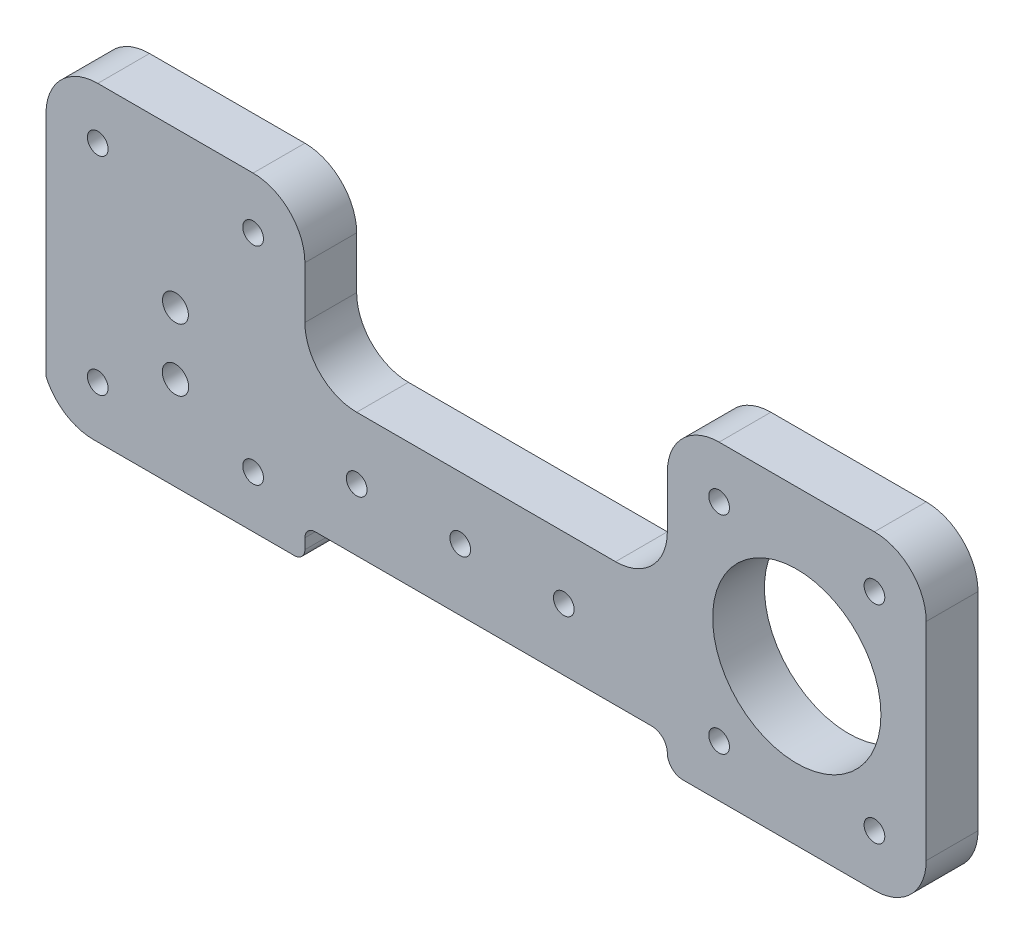
from build123d import *

# Parameters (mm, degrees)
MODEL_R             = 2
MODEL_R_2           = 2.5
MODEL_R_3           = 2.55
MODEL_R_4           = 16.25
BOSS_EXTRUDE1_DEPTH = 10


with BuildPart() as part:
    # Model → Boss-Extrude1 (new body)
    with BuildSketch(Plane.XY):
        with BuildLine():
            Line((-13.089430894, 50), (-13.089430894, 6))
            ThreePointArc((-13.089430894, 6), (-9.401505079, 1.633399735), (-3.924279504, 0))
            Line((-3.924279504, 0), (34.910569106, 0))
            ThreePointArc((34.910569106, 0), (36.324782668, 0.585786438), (36.910569106, 2))
            Line((36.910569106, 2), (36.910569106, 4))
            ThreePointArc((36.910569106, 4), (37.496355543, 5.414213562), (38.910569106, 6))
            Line((38.910569106, 6), (103.910569106, 6))
            ThreePointArc((103.910569106, 6), (106.031889449, 5.121320344), (106.910569106, 3))
            ThreePointArc((106.910569106, 3), (107.789248762, 0.878679656), (109.910569106, 0))
            Line((109.910569106, 0), (146.910569106, 0))
            ThreePointArc((146.910569106, 0), (153.981636918, 2.928932188), (156.910569106, 10))
            Line((156.910569106, 10), (156.910569106, 50))
            ThreePointArc((156.910569106, 50), (153.981636918, 57.071067812), (146.910569106, 60))
            Line((146.910569106, 60), (116.910569106, 60))
            ThreePointArc((116.910569106, 60), (109.839501294, 57.071067812), (106.910569106, 50))
            Line((106.910569106, 50), (106.910569106, 40))
            ThreePointArc((106.910569106, 40), (103.981636918, 32.928932188), (96.910569106, 30))
            Line((96.910569106, 30), (46.910569106, 30))
            ThreePointArc((46.910569106, 30), (39.839501294, 32.928932188), (36.910569106, 40))
            Line((36.910569106, 40), (36.910569106, 50))
            ThreePointArc((36.910569106, 50), (33.981636918, 57.071067812), (26.910569106, 60))
            Line((26.910569106, 60), (-3.089430894, 60))
            ThreePointArc((-3.089430894, 60), (-10.160498706, 57.071067812), (-13.089430894, 50))
        make_face()
        with Locations((26.910569106, 50)):
            Circle(MODEL_R, mode=Mode.SUBTRACT)
        with Locations((26.910569106, 10)):
            Circle(MODEL_R, mode=Mode.SUBTRACT)
        with Locations((11.910569106, 30)):
            Circle(MODEL_R_2, mode=Mode.SUBTRACT)
        with Locations((146.910569106, 50)):
            Circle(MODEL_R, mode=Mode.SUBTRACT)
        with Locations((86.910569106, 18)):
            Circle(MODEL_R, mode=Mode.SUBTRACT)
        with Locations((146.910569106, 10)):
            Circle(MODEL_R, mode=Mode.SUBTRACT)
        with Locations((116.910569106, 10)):
            Circle(MODEL_R, mode=Mode.SUBTRACT)
        with Locations((46.910569106, 18)):
            Circle(MODEL_R, mode=Mode.SUBTRACT)
        with Locations((66.910569106, 18)):
            Circle(MODEL_R, mode=Mode.SUBTRACT)
        with Locations((116.910569106, 50)):
            Circle(MODEL_R, mode=Mode.SUBTRACT)
        with Locations((11.910569106, 18)):
            Circle(MODEL_R_3, mode=Mode.SUBTRACT)
        with Locations((-3.089430894, 10)):
            Circle(MODEL_R, mode=Mode.SUBTRACT)
        with Locations((-3.089430894, 50)):
            Circle(MODEL_R, mode=Mode.SUBTRACT)
        with Locations((131.910569106, 30)):
            Circle(MODEL_R_4, mode=Mode.SUBTRACT)
    extrude(amount=BOSS_EXTRUDE1_DEPTH)


solid = part.part
